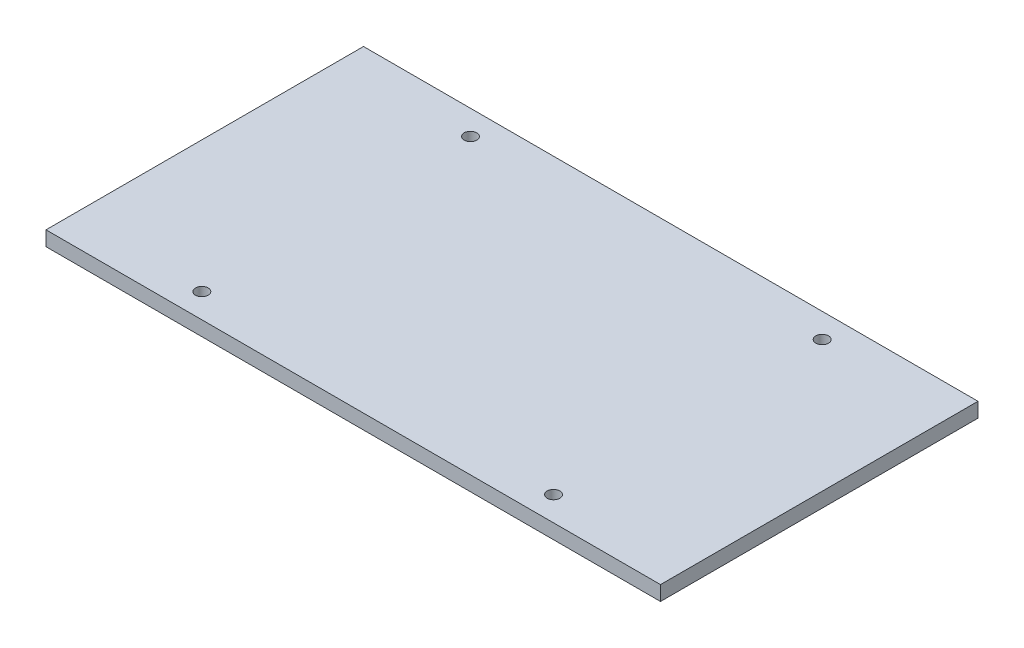
from build123d import *

# Parameters (mm, degrees)
SKETCH_1_W      = 125.8
SKETCH_1_H      = 65
SKETCH_1_R      = 1.3
EXTRUDE_1_DEPTH = 3


with BuildPart() as part:
    # ｽｹｯﾁ1 → ﾎﾞｽ - 押し出し1 (new body)
    with BuildSketch(Plane(origin=(0, 0, 0), x_dir=(1, 0, 0), z_dir=(0, 1, 0))):
        with Locations((62.9, 32.5)):
            Rectangle(SKETCH_1_W, SKETCH_1_H)
        with Locations(Location((26.9, 60, 0), (0, 0, 270))):
            Circle(SKETCH_1_R, mode=Mode.SUBTRACT)
        with Locations(Location((98.9, 60, 0), (0, 0, 270))):
            Circle(SKETCH_1_R, mode=Mode.SUBTRACT)
        with Locations(Location((98.9, 5, 0), (0, 0, 270))):
            Circle(SKETCH_1_R, mode=Mode.SUBTRACT)
        with Locations(Location((26.9, 5, 0), (0, 0, 270))):
            Circle(SKETCH_1_R, mode=Mode.SUBTRACT)
    extrude(amount=EXTRUDE_1_DEPTH)


solid = part.part
